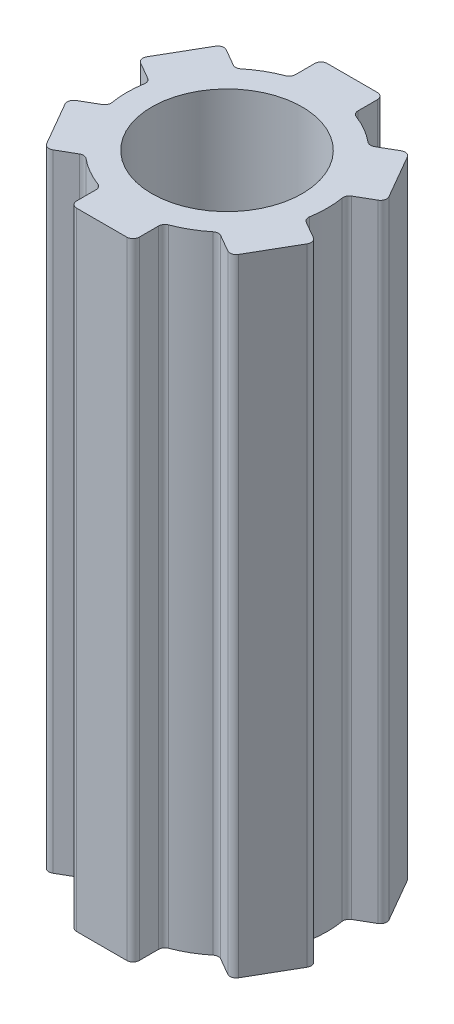
from build123d import *

# Parameters (mm, degrees)
BOSS_EXTRUDE2_DEPTH = 25.4
SKETCH5_R           = 3.048
CUT_EXTRUDE1_DEPTH  = 27.387718251
FILLET1_R           = 0.254


with BuildPart() as part:
    # Sketch4 → Boss-Extrude2 (new body)
    with BuildSketch(Plane(origin=(0, 0, 0), x_dir=(1, 0, 0), z_dir=(0, 1, 0))):
        with BuildLine():
            Line((1.27, 5.08), (-1.27, 5.08))
            Line((-1.27, 5.08), (-1.27, 3.860465775))
            ThreePointArc((-1.27, 3.860465775), (-2.032, 3.519527241), (-2.708261432, 3.03008515))
            Line((-2.708261432, 3.03008515), (-3.764409051, 3.639852263))
            Line((-3.764409051, 3.639852263), (-5.034409051, 1.440147737))
            Line((-5.034409051, 1.440147737), (-3.978261432, 0.830380625))
            ThreePointArc((-3.978261432, 0.830380625), (-4.064, 0), (-3.978261432, -0.830380625))
            Line((-3.978261432, -0.830380625), (-5.034409051, -1.440147737))
            Line((-5.034409051, -1.440147737), (-3.764409051, -3.639852263))
            Line((-3.764409051, -3.639852263), (-2.708261432, -3.03008515))
            ThreePointArc((-2.708261432, -3.03008515), (-2.032, -3.519527241), (-1.27, -3.860465775))
            Line((-1.27, -3.860465775), (-1.27, -5.08))
            Line((-1.27, -5.08), (1.27, -5.08))
            Line((1.27, -5.08), (1.27, -3.860465775))
            ThreePointArc((1.27, -3.860465775), (2.032, -3.519527241), (2.708261432, -3.03008515))
            Line((2.708261432, -3.03008515), (3.764409051, -3.639852263))
            Line((3.764409051, -3.639852263), (5.034409051, -1.440147737))
            Line((5.034409051, -1.440147737), (3.978261432, -0.830380625))
            ThreePointArc((3.978261432, -0.830380625), (4.064, 0), (3.978261432, 0.830380625))
            Line((3.978261432, 0.830380625), (5.034409051, 1.440147737))
            Line((5.034409051, 1.440147737), (3.764409051, 3.639852263))
            Line((3.764409051, 3.639852263), (2.708261432, 3.03008515))
            ThreePointArc((2.708261432, 3.03008515), (2.032, 3.519527241), (1.27, 3.860465775))
            Line((1.27, 3.860465775), (1.27, 5.08))
        make_face()
    extrude(amount=BOSS_EXTRUDE2_DEPTH)

    # Sketch5 → Cut-Extrude1 (cut, through all)
    with BuildSketch(Plane(origin=(0, 25.4, 0), x_dir=(1, 0, 0), z_dir=(0, 1, 0))):
        Circle(SKETCH5_R)
    extrude(amount=-CUT_EXTRUDE1_DEPTH, mode=Mode.SUBTRACT)

    # Fillet1
    fillet1_edges = [part.edges().sort_by_distance(p)[0] for p in [
        (5.034409051, 12.7, -1.440147737),
        (3.978261432, 12.7, -0.830380625),
        (3.978261432, 12.7, 0.830380625),
        (5.034409051, 12.7, 1.440147737),
        (3.764409051, 12.7, 3.639852263),
        (2.708261432, 12.7, 3.03008515),
        (1.27, 12.7, 5.08),
        (1.27, 12.7, 3.860465775),
        (-1.27, 12.7, 5.08),
        (-1.27, 12.7, 3.860465775),
        (-2.708261432, 12.7, 3.03008515),
        (-3.764409051, 12.7, 3.639852263),
        (-5.034409051, 12.7, 1.440147737),
        (-3.978261432, 12.7, 0.830380625),
        (-3.978261432, 12.7, -0.830380625),
        (-5.034409051, 12.7, -1.440147737),
        (-3.764409051, 12.7, -3.639852263),
        (-1.27, 12.7, -3.860465775),
        (-2.708261432, 12.7, -3.03008515),
        (-1.27, 12.7, -5.08),
        (1.27, 12.7, -5.08),
        (1.27, 12.7, -3.860465775),
        (3.764409051, 12.7, -3.639852263),
        (2.708261432, 12.7, -3.03008515),
    ]]
    fillet(fillet1_edges, radius=FILLET1_R)


solid = part.part
